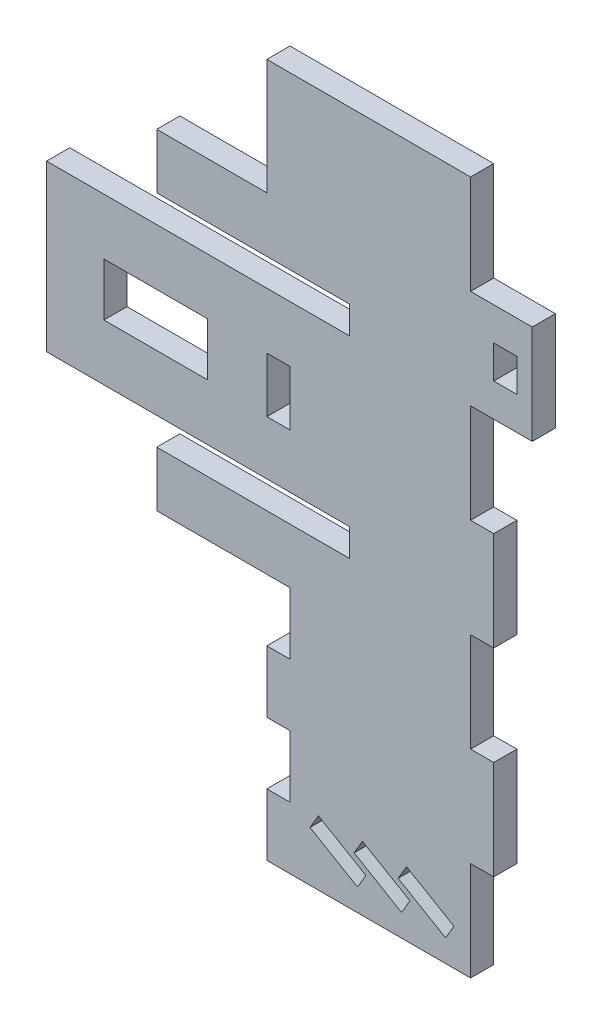
from build123d import *

# Parameters (mm, degrees)
SKETCH1_W           = 52.324
SKETCH1_H           = 160.02
BOSS_EXTRUDE1_DEPTH = 5.334
SKETCH2_W           = 5.334
SKETCH2_H           = 22.86
CUT_EXTRUDE1_DEPTH  = 115.417820658
SKETCH3_W           = 5.334
SKETCH3_H           = 38.1
BOSS_EXTRUDE2_DEPTH = 50.8
SKETCH4_W           = 23.876
SKETCH4_H           = 12.192
CUT_EXTRUDE2_DEPTH  = 151.047185381
SKETCH5_W           = 19.05
SKETCH5_H           = 6.35
CUT_EXTRUDE3_DEPTH  = 151.047185381
SKETCH6_W           = 5.334
SKETCH6_H           = 12.7
BOSS_EXTRUDE3_DEPTH = 25.4
SKETCH7_W           = 5.334
SKETCH7_H           = 12.7
BOSS_EXTRUDE4_DEPTH = 25.4
SKETCH8_W           = 5.334
SKETCH8_H           = 14.2875
CUT_EXTRUDE4_DEPTH  = 151.047185381
SKETCH9_W           = 5.334
SKETCH9_H           = 12.7
CUT_EXTRUDE5_DEPTH  = 151.047185381
CUT_EXTRUDE6_DEPTH  = 151.047185381
SKETCH11_W          = 5.334
SKETCH11_H          = 22.86
BOSS_EXTRUDE5_DEPTH = 8.89
SKETCH12_W          = 5.334
SKETCH12_H          = 7.62
CUT_EXTRUDE7_DEPTH  = 151.047185381


with BuildPart() as part:
    # Sketch1 → Boss-Extrude1 (new body)
    with BuildSketch(Plane.XY):
        with Locations((-41.181308627, -12.336439624)):
            Rectangle(SKETCH1_W, SKETCH1_H)
    extrude(amount=BOSS_EXTRUDE1_DEPTH)

    # Sketch2 → Cut-Extrude1 (cut, through all)
    with BuildSketch(Plane.XY.offset(5.334)):
        with Locations((-17.686308627, 56.243560376)):
            Rectangle(SKETCH2_W, SKETCH2_H)
        with Locations((-17.686308627, 10.523560376)):
            Rectangle(SKETCH2_W, SKETCH2_H)
        with Locations((-17.686308627, -35.196439624)):
            Rectangle(SKETCH2_W, SKETCH2_H)
        with Locations((-17.686308627, -80.916439624)):
            Rectangle(SKETCH2_W, SKETCH2_H)
    extrude(amount=-CUT_EXTRUDE1_DEPTH, mode=Mode.SUBTRACT)

    # Sketch3 → Boss-Extrude2 (add)
    with BuildSketch(Plane.ZY.offset(67.343308627)):
        with Locations((2.667, 2.903560376)):
            Rectangle(SKETCH3_W, SKETCH3_H)
    extrude(amount=BOSS_EXTRUDE2_DEPTH)

    # Sketch4 → Cut-Extrude2 (cut, through all)
    with BuildSketch(Plane.XY.offset(5.334)):
        with Locations((-92.997308627, 2.903560376)):
            Rectangle(SKETCH4_W, SKETCH4_H)
    extrude(amount=-CUT_EXTRUDE2_DEPTH, mode=Mode.SUBTRACT)

    # Sketch5 → Cut-Extrude3 (cut, through all)
    with BuildSketch(Plane.XY.offset(5.334)):
        with Locations((-57.818308627, 25.128560376)):
            Rectangle(SKETCH5_W, SKETCH5_H)
        with Locations((-57.818308627, -19.321439624)):
            Rectangle(SKETCH5_W, SKETCH5_H)
    extrude(amount=-CUT_EXTRUDE3_DEPTH, mode=Mode.SUBTRACT)

    # Sketch6 → Boss-Extrude3 (add)
    with BuildSketch(Plane.ZY.offset(67.343308627)):
        with Locations((2.667, 34.653560376)):
            Rectangle(SKETCH6_W, SKETCH6_H)
    extrude(amount=BOSS_EXTRUDE3_DEPTH)

    # Sketch7 → Boss-Extrude4 (add)
    with BuildSketch(Plane.ZY.offset(67.343308627)):
        with Locations((2.667, -28.846439624)):
            Rectangle(SKETCH7_W, SKETCH7_H)
    extrude(amount=BOSS_EXTRUDE4_DEPTH)

    # Sketch8 → Cut-Extrude4 (cut, through all)
    with BuildSketch(Plane.XY.offset(5.334)):
        with Locations((-64.676308627, -42.340189624)):
            Rectangle(SKETCH8_W, SKETCH8_H)
        with Locations((-64.676308627, -70.915189624)):
            Rectangle(SKETCH8_W, SKETCH8_H)
    extrude(amount=-CUT_EXTRUDE4_DEPTH, mode=Mode.SUBTRACT)

    # Sketch9 → Cut-Extrude5 (cut, through all)
    with BuildSketch(Plane.XY.offset(5.334)):
        with Locations((-64.676308627, 2.649560376)):
            Rectangle(SKETCH9_W, SKETCH9_H)
    extrude(amount=-CUT_EXTRUDE5_DEPTH, mode=Mode.SUBTRACT)

    # Sketch10 → Cut-Extrude6 (cut, through all)
    with BuildSketch(Plane.XY.offset(5.334)):
        Polygon((-57.379441561, -80.781874862), (-46.432343901, -87.220124068), (-44.50086914, -83.93599477), (-55.447966799, -77.497745564), align=None)
        Polygon((-45.287966799, -77.497745564), (-34.34086914, -83.93599477), (-36.272343901, -87.220124068), (-47.219441561, -80.781874862), align=None)
        Polygon((-35.127966799, -77.497745564), (-24.18086914, -83.93599477), (-26.112343901, -87.220124068), (-37.059441561, -80.781874862), align=None)
    extrude(amount=-CUT_EXTRUDE6_DEPTH, mode=Mode.SUBTRACT)

    # Sketch11 → Boss-Extrude5 (add)
    with BuildSketch(Plane(origin=(-15.019308627, 0, 0), x_dir=(0, 0, -1), z_dir=(1, 0, 0))):
        with Locations((-2.667, 33.383560376)):
            Rectangle(SKETCH11_W, SKETCH11_H)
    extrude(amount=BOSS_EXTRUDE5_DEPTH)

    # Sketch12 → Cut-Extrude7 (cut, through all)
    with BuildSketch(Plane.XY.offset(5.334)):
        with Locations((-12.352308627, 33.383560376)):
            Rectangle(SKETCH12_W, SKETCH12_H)
    extrude(amount=-CUT_EXTRUDE7_DEPTH, mode=Mode.SUBTRACT)


solid = part.part
